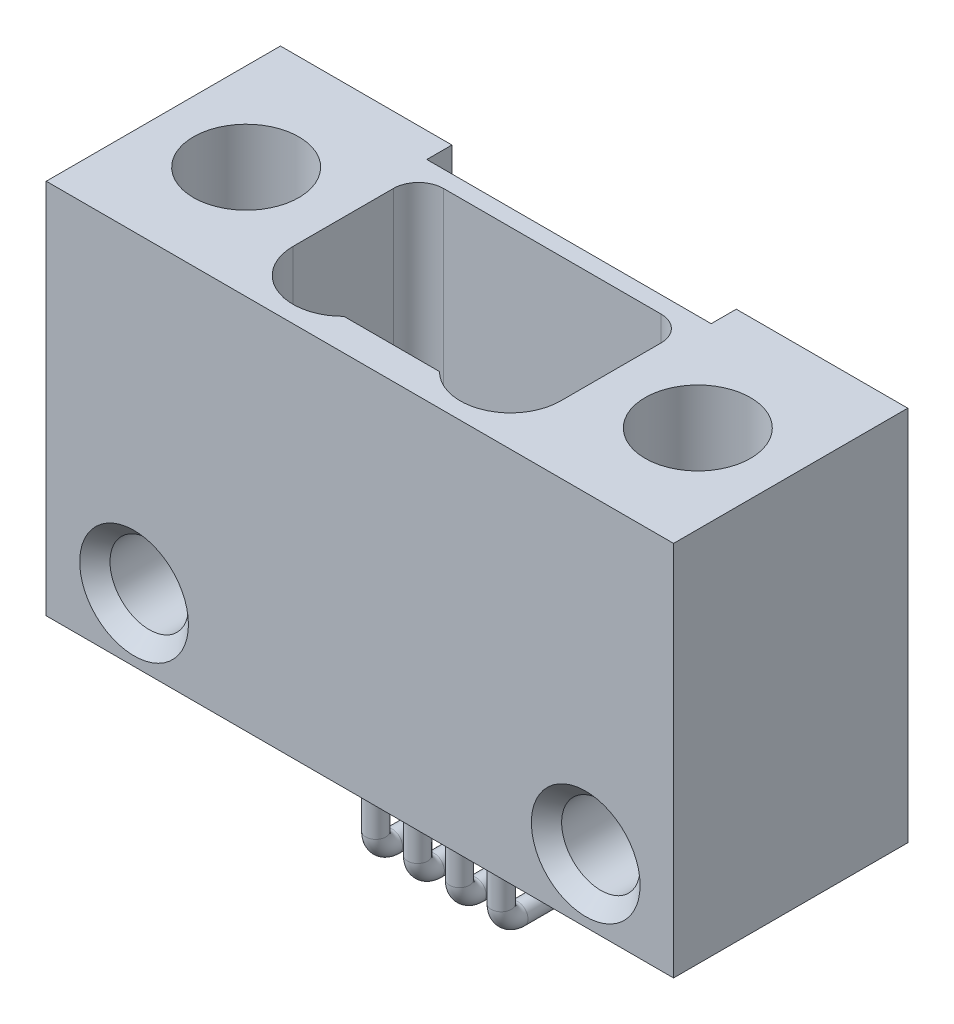
from build123d import *

# Parameters (mm, degrees)
BOSS_EXTRUDE2_DEPTH            = 5.715
CUT_EXTRUDE1_START             = 1.016
CUT_EXTRUDE1_DEPTH             = 7.650856519
SKETCH4_R                      = 0.1524
SKETCH8_R                      = 0.8001
CUT_EXTRUDE2_DEPTH             = 2.54
F_0_80_TAPPED_HOLE1_AT_2_COUNT = 2
F_0_80_TAPPED_HOLE1_AT_2_PITCH = 6.858
SKETCH12_R                     = 0.1524


with BuildPart() as part:
    # Sketch2 → Boss-Extrude2 (new body)
    with BuildSketch(Plane(origin=(0, 0, 0), x_dir=(1, 0, 0), z_dir=(0, 1, 0))):
        Polygon((-2.159, 1.8542), (-2.159, 1.4732), (2.159, 1.4732), (2.159, 1.8542), (4.7625, 1.8542), (4.7625, -1.7018), (-4.7625, -1.7018), (-4.7625, 1.8542), align=None)
    extrude(amount=BOSS_EXTRUDE2_DEPTH)

    # Sketch7 → Cut-Extrude1 (cut, through all)
    with BuildSketch(Plane(origin=(0, 0, 0), x_dir=(1, 0, 0), z_dir=(0, 1, 0)).offset(CUT_EXTRUDE1_START)):
        with BuildLine():
            Line((-1.651, 1.2192), (1.651, 1.2192))
            ThreePointArc((1.651, 1.2192), (1.920407684, 1.107607684), (2.032, 0.8382))
            Line((2.032, 0.8382), (2.032, -0.6858))
            ThreePointArc((2.032, -0.6858), (1.558080929, -1.391245518), (0.725823154, -1.2192))
            Line((0.725823154, -1.2192), (-0.725823154, -1.2192))
            ThreePointArc((-0.725823154, -1.2192), (-1.558080929, -1.391245518), (-2.032, -0.6858))
            Line((-2.032, -0.6858), (-2.032, 0.8382))
            ThreePointArc((-2.032, 0.8382), (-1.920407684, 1.107607684), (-1.651, 1.2192))
        make_face()
    extrude(amount=CUT_EXTRUDE1_DEPTH, mode=Mode.SUBTRACT)

    # Sweep1: sweep along a path in Sketch3
    with BuildLine(Plane(origin=(0, 0, 0), x_dir=(0, 0, -1), z_dir=(1, 0, 0))) as sweep1_path:
        Line((0.508, 0), (0.508, -0.254))
        ThreePointArc((0.508, -0.254), (0.582394878, -0.433605122), (0.762, -0.508))
        Line((0.762, -0.508), (1.4224, -0.508))
        ThreePointArc((1.4224, -0.508), (1.602005122, -0.582394878), (1.6764, -0.762))
        Line((1.6764, -0.762), (1.6764, -1.2446))
    # Sketch4 → Sweep1 (sweep)
    with BuildSketch(Plane(origin=(0, 0, 0), x_dir=(1, 0, 0), z_dir=(0, 1, 0))):
        with Locations((1.27, 0.508)):
            Circle(SKETCH4_R)
        with Locations((0.635, 0.508)):
            Circle(SKETCH4_R)
        with Locations((0, 0.508)):
            Circle(SKETCH4_R)
        with Locations((-0.635, 0.508)):
            Circle(SKETCH4_R)
        with Locations((-1.27, 0.508)):
            Circle(SKETCH4_R)
    sweep(path=sweep1_path.line)

    # Sketch8 → Cut-Extrude2 (cut)
    with BuildSketch(Plane(origin=(0, 5.715, 0), x_dir=(1, 0, 0), z_dir=(0, 1, 0))):
        with Locations(Location((3.429, 0, 0), (0, 0, 270))):
            Circle(SKETCH8_R)
        with Locations(Location((-3.429, 0, 0), (0, 0, 270))):
            Circle(SKETCH8_R)
    extrude(amount=-CUT_EXTRUDE2_DEPTH, mode=Mode.SUBTRACT)

    # Sketch10 → #0-80 Tapped Hole1 (revolve, cut)
    with BuildSketch(Plane(origin=(3.429, 0.9652, 1.7018), x_dir=(0, -1, 0), z_dir=(1, 0, 0))):
        Polygon((0, 0), (0, 3.556), (0.8255, 3.556), (0.59563, 3.32613), (0.59563, 0.22987), (0.8255, 0), align=None)
    f_0_80_tapped_hole1 = revolve(axis=Axis((3.429, 0.9652, 8.0518), (0, 0, -1)), mode=Mode.SUBTRACT)

    # #0-80 Tapped Hole1 at 2: #0-80 Tapped Hole1 ×2
    with Locations(*[(-i * F_0_80_TAPPED_HOLE1_AT_2_PITCH, 0, 0) for i in range(1, F_0_80_TAPPED_HOLE1_AT_2_COUNT)]):
        add(f_0_80_tapped_hole1, mode=Mode.SUBTRACT)

    # Sweep2: sweep along a path in Sketch13
    with BuildLine(Plane(origin=(0, 0, 0), x_dir=(0, 0, -1), z_dir=(1, 0, 0))) as sweep2_path:
        Line((-0.508, 0), (-0.508, -1.524))
        ThreePointArc((-0.508, -1.524), (-0.433605122, -1.703605122), (-0.254, -1.778))
        Line((-0.254, -1.778), (1.4224, -1.778))
        ThreePointArc((1.4224, -1.778), (1.602005122, -1.852394878), (1.6764, -2.032))
        Line((1.6764, -2.032), (1.6764, -2.5146))
    # Sketch12 → Sweep2 (sweep)
    with BuildSketch(Plane(origin=(0, 0, 0), x_dir=(1, 0, 0), z_dir=(0, 1, 0))):
        with Locations((0.9525, -0.508)):
            Circle(SKETCH12_R)
        with Locations((0.3175, -0.508)):
            Circle(SKETCH12_R)
        with Locations((-0.3175, -0.508)):
            Circle(SKETCH12_R)
        with Locations((-0.9525, -0.508)):
            Circle(SKETCH12_R)
    sweep(path=sweep2_path.line)


solid = part.part
